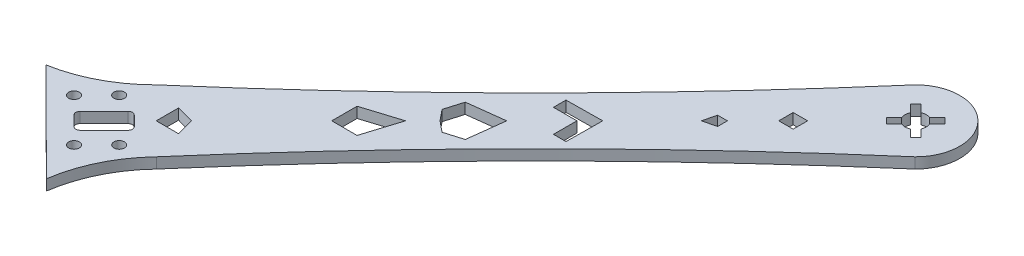
from build123d import *

# Parameters (mm, degrees)
SKETCH1_R           = 2.5
BOSS_EXTRUDE2_DEPTH = 5


with BuildPart() as part:
    # Sketch1 → Boss-Extrude2 (new body)
    with BuildSketch(Plane(origin=(0, 0, 0), x_dir=(1, 0, 0), z_dir=(0, 1, 0))):
        with BuildLine():
            ThreePointArc((48.157439134, 86.819747349), (32.548521434, 75.332166703), (14.205825824, 69.075303385))
            Line((14.205825824, 69.075303385), (60.601080618, 22.857899217))
            ThreePointArc((60.601080618, 22.857899217), (66.335448138, 41.548589345), (77.473000793, 57.616563367))
            Line((77.473000793, 57.616563367), (77.416811954, 57.560374528))
            ThreePointArc((77.416811954, 57.560374528), (163.240056955, 149.970690922), (255.650373348, 235.793935922))
            ThreePointArc((255.650373348, 235.793935922), (255.754156467, 265.157091862), (226.391000527, 265.053308743))
            ThreePointArc((226.391000527, 265.053308743), (140.567755527, 172.64299235), (48.157439134, 86.819747349))
        make_face()
        with Locations(Location((53.318451782, 43.121161597, 0), (0, 0, 270))):
            Circle(SKETCH1_R, mode=Mode.SUBTRACT)
        with Locations(Location((63.9250535, 53.727763315, 0), (0, 0, 270))):
            Circle(SKETCH1_R, mode=Mode.SUBTRACT)
        with Locations(Location((33.098323122, 63.341290256, 0), (0, 0, 270))):
            Circle(SKETCH1_R, mode=Mode.SUBTRACT)
        with Locations(Location((43.70492484, 73.947891974, 0), (0, 0, 270))):
            Circle(SKETCH1_R, mode=Mode.SUBTRACT)
        with BuildLine():
            Line((55.229202732, 69.494681894), (60.091746499, 64.632138127))
            ThreePointArc((60.091746499, 64.632138127), (60.677532937, 63.217924565), (60.091746499, 61.803711002))
            Line((60.091746499, 61.803711002), (48.778038, 50.490002503))
            ThreePointArc((48.778038, 50.490002503), (47.363824438, 49.904216066), (45.949610875, 50.490002503))
            Line((45.949610875, 50.490002503), (41.087067109, 55.35254627))
            ThreePointArc((41.087067109, 55.35254627), (40.501280671, 56.766759833), (41.087067109, 58.180973395))
            Line((41.087067109, 58.180973395), (52.400775608, 69.494681894))
            ThreePointArc((52.400775608, 69.494681894), (53.81498917, 70.080468332), (55.229202732, 69.494681894))
        make_face(mode=Mode.SUBTRACT)
        Polygon((73.358826127, 72.218155358), (62.815219963, 72.218155358), (62.815219963, 82.761761522), (71.072742678, 80.475678073), align=None, mode=Mode.SUBTRACT)
        Polygon((115.901419717, 113.431281172), (104.028345777, 113.431281172), (104.028345777, 125.304355111), (121.370050098, 130.772985493), align=None, mode=Mode.SUBTRACT)
        Polygon((127.774493656, 152.369634944), (145.10497222, 154.507907615), (142.966699549, 137.177429051), (134.556556076, 134.683417686), (129.44306902, 138.846004415), (125.280482291, 143.959491471), align=None, mode=Mode.SUBTRACT)
        Polygon((161.578803014, 170.981738409), (150.580944654, 170.981738409), (150.580944654, 176.860832319), (167.661082015, 177.06401741), (167.457896924, 159.983880049), (161.578803014, 159.983880049), align=None, mode=Mode.SUBTRACT)
        Polygon((192.31024704, 206.32683153), (196.923896135, 206.32683153), (196.923896135, 201.713182434), (190.803246876, 200.206182271), align=None, mode=Mode.SUBTRACT)
        Polygon((215.737142693, 218.36823138), (208.965295985, 218.36823138), (208.965295985, 225.140078087), (215.779590379, 225.182525773), align=None, mode=Mode.SUBTRACT)
        with BuildLine():
            ThreePointArc((239.098412236, 255.098316632), (241.12410453, 255.527039925), (243.149796825, 255.098316632))
            Line((243.149796825, 255.098316632), (246.685330731, 258.633850538))
            Line((246.685330731, 258.633850538), (249.230915143, 256.088266125))
            Line((249.230915143, 256.088266125), (245.695381237, 252.552732219))
            ThreePointArc((245.695381237, 252.552732219), (246.12410453, 250.527039925), (245.695381237, 248.501347631))
            Line((245.695381237, 248.501347631), (249.230915143, 244.965813725))
            Line((249.230915143, 244.965813725), (246.685330731, 242.420229312))
            Line((246.685330731, 242.420229312), (243.149796825, 245.955763218))
            ThreePointArc((243.149796825, 245.955763218), (241.12410453, 245.527039925), (239.098412236, 245.955763218))
            Line((239.098412236, 245.955763218), (235.56287833, 242.420229312))
            Line((235.56287833, 242.420229312), (233.017293918, 244.965813725))
            Line((233.017293918, 244.965813725), (236.552827824, 248.501347631))
            ThreePointArc((236.552827824, 248.501347631), (236.12410453, 250.527039925), (236.552827824, 252.552732219))
            Line((236.552827824, 252.552732219), (233.017293918, 256.088266125))
            Line((233.017293918, 256.088266125), (235.56287833, 258.633850538))
            Line((235.56287833, 258.633850538), (239.098412236, 255.098316632))
        make_face(mode=Mode.SUBTRACT)
    extrude(amount=-BOSS_EXTRUDE2_DEPTH)


solid = part.part
